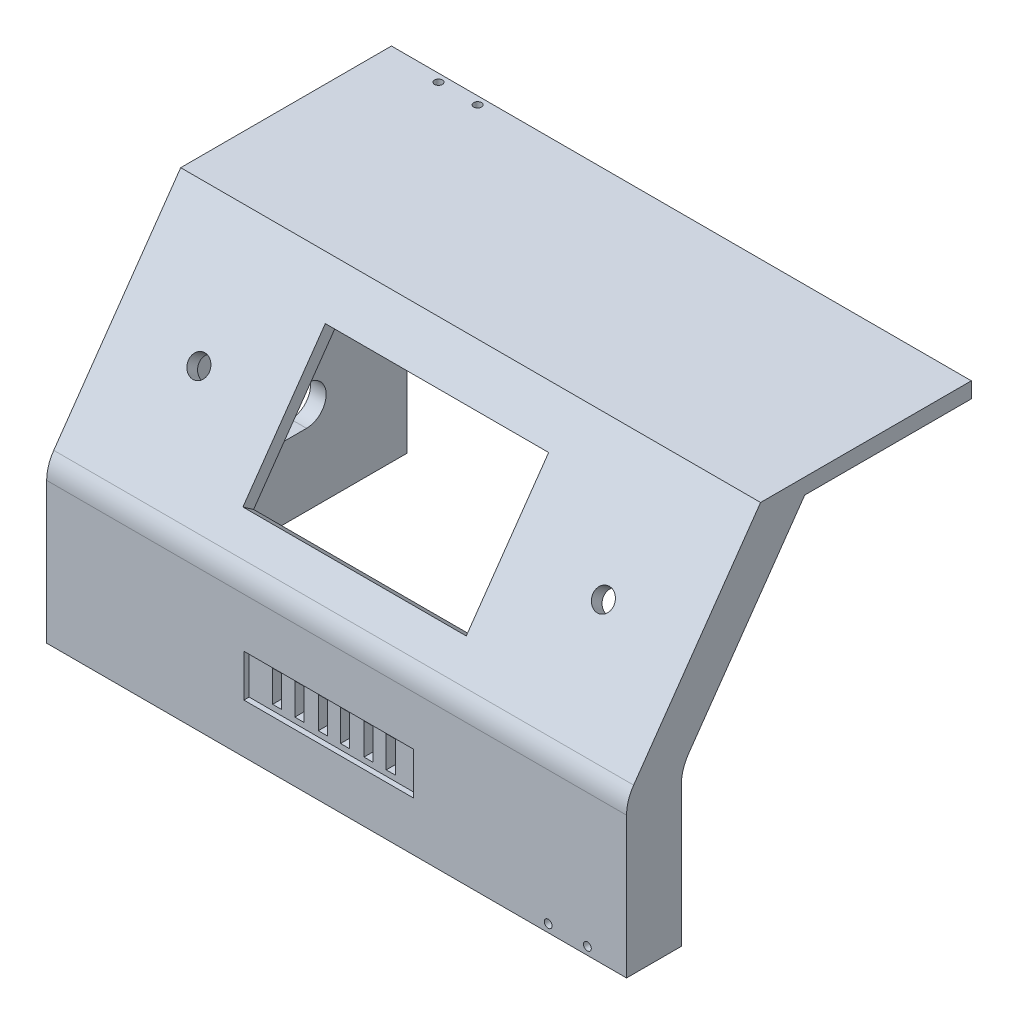
from build123d import *

# Parameters (mm, degrees)
SKETCH1_W            = 111
SKETCH1_H            = 126
BOSS_EXTRUDE1_DEPTH  = 6
SKETCH2_W            = 216
SKETCH2_H            = 111
BOSS_EXTRUDE2_DEPTH  = 6
SKETCH3_W            = 216
SKETCH3_H            = 132
BOSS_EXTRUDE3_DEPTH  = 6
SKETCH5_W            = 216
SKETCH5_H            = 99.986345045
CUT_EXTRUDE1_DEPTH   = 75
SKETCH7_W            = 216
SKETCH7_H            = 99.986345045
BOSS_EXTRUDE4_DEPTH  = 5
CUT_EXTRUDE2_DEPTH   = 314
SKETCH9_W            = 85.5
SKETCH9_H            = 55
CUT_EXTRUDE3_DEPTH   = 14
FILLET1_R            = 15
CUT_EXTRUDE4_DEPTH   = 27
SKETCH11_W           = 65
SKETCH11_H           = 16.2
CUT_EXTRUDE5_DEPTH   = 2
SKETCH12_W           = 3.5
SKETCH12_H           = 12
CUT_EXTRUDE6_DEPTH   = 11
BOSS_EXTRUDE5_DEPTH  = 6
SKETCH22_R           = 1.5
CUT_EXTRUDE13_DEPTH  = 20
BOSS_EXTRUDE6_DEPTH  = 15
SKETCH25_R           = 1.5
CUT_EXTRUDE14_DEPTH  = 15
BOSS_EXTRUDE9_START  = -6
BOSS_EXTRUDE9_DEPTH  = 6
SKETCH35_W           = 210
SKETCH35_H           = 6
SKETCH35_R           = 1.5
BOSS_EXTRUDE10_DEPTH = 15
SKETCH36_R           = 4
CUT_EXTRUDE16_DEPTH  = 15
SKETCH37_R           = 4
CUT_EXTRUDE17_DEPTH  = 15


with BuildPart() as part:
    # Sketch1 → Boss-Extrude1 (new body)
    with BuildSketch(Plane(origin=(0, 0, 0), x_dir=(0, 0, -1), z_dir=(1, 0, 0))):
        with Locations((55.5, 63)):
            Rectangle(SKETCH1_W, SKETCH1_H)
    extrude(amount=BOSS_EXTRUDE1_DEPTH)

    # Sketch2 → Boss-Extrude2 (add)
    with BuildSketch(Plane(origin=(0, 126, 0), x_dir=(1, 0, 0), z_dir=(0, 1, 0))):
        with Locations((108, 55.5)):
            Rectangle(SKETCH2_W, SKETCH2_H)
    extrude(amount=BOSS_EXTRUDE2_DEPTH)

    # Sketch3 → Boss-Extrude3 (add)
    with BuildSketch(Plane.XY):
        with Locations((108, 66)):
            Rectangle(SKETCH3_W, SKETCH3_H)
    extrude(amount=BOSS_EXTRUDE3_DEPTH)

    # Sketch5 → Cut-Extrude1 (cut)
    with BuildSketch(Plane(origin=(0, 19.268574279, 27.51837595), x_dir=(1, 0, 0), z_dir=(0, -0.5735764363510416, -0.8191520442889949))):
        with Locations((108, -87.509316119)):
            Rectangle(SKETCH5_W, SKETCH5_H)
    extrude(amount=-CUT_EXTRUDE1_DEPTH, mode=Mode.SUBTRACT)

    # Sketch7 → Boss-Extrude4 (add)
    with BuildSketch(Plane(origin=(0, 19.268574279, 27.51837595), x_dir=(1, 0, 0), z_dir=(0, -0.5735764363510416, -0.8191520442889949))):
        with Locations((108, -87.509316119)):
            Rectangle(SKETCH7_W, SKETCH7_H)
    extrude(amount=-BOSS_EXTRUDE4_DEPTH)

    # Sketch8 → Cut-Extrude2 (cut)
    with BuildSketch(Plane(origin=(216, 0, 0), x_dir=(0, 0, -1), z_dir=(1, 0, 0))):
        Polygon((-6, 50), (-6, 58.717233978), (-10.095760221, 52.867882182), align=None)
        Polygon((51.212736322, 132), (45.313145189, 132), (47.254051253, 134.771901126), align=None)
    extrude(amount=-CUT_EXTRUDE2_DEPTH, mode=Mode.SUBTRACT)

    # Sketch9 → Cut-Extrude3 (cut)
    with BuildSketch(Plane(origin=(0, 22.136456461, 31.614136171), x_dir=(1, 0, 0), z_dir=(0, 0.5735764363510417, 0.8191520442889949))):
        with Locations((108, 89.387752907)):
            Rectangle(SKETCH9_W, SKETCH9_H)
    extrude(amount=-CUT_EXTRUDE3_DEPTH, mode=Mode.SUBTRACT)

    # Fillet1
    fillet1_edges = [part.edges().sort_by_distance(p)[0] for p in [
        (111, 58.56888804, 0),
        (108, 58.717233978, 6),
    ]]
    fillet(fillet1_edges, radius=FILLET1_R)

    # Sketch10 → Cut-Extrude4 (cut)
    with BuildSketch(Plane.ZY):
        with BuildLine():
            Line((-87.5, 42.5), (-17.5, 42.5))
            ThreePointArc((-17.5, 42.5), (-10, 35), (-17.5, 27.5))
            Line((-17.5, 27.5), (-87.5, 27.5))
            ThreePointArc((-87.5, 27.5), (-95, 35), (-87.5, 42.5))
        make_face()
        with BuildLine():
            Line((-89.152421831, 99.5), (-39.152421831, 99.5))
            ThreePointArc((-39.152421831, 99.5), (-31.652421831, 92), (-39.152421831, 84.5))
            Line((-39.152421831, 84.5), (-89.152421831, 84.5))
            ThreePointArc((-89.152421831, 84.5), (-96.652421831, 92), (-89.152421831, 99.5))
        make_face()
    extrude(amount=-CUT_EXTRUDE4_DEPTH, mode=Mode.SUBTRACT)

    # Sketch11 → Cut-Extrude5 (cut)
    with BuildSketch(Plane.XY.offset(6)):
        with Locations((108, 26.993876072)):
            Rectangle(SKETCH11_W, SKETCH11_H)
    extrude(amount=-CUT_EXTRUDE5_DEPTH, mode=Mode.SUBTRACT)

    # Sketch12 → Cut-Extrude6 (cut)
    with BuildSketch(Plane.XY.offset(4)):
        with Locations((86.25, 26.993876072)):
            Rectangle(SKETCH12_W, SKETCH12_H)
        with Locations((94.75, 26.993876072)):
            Rectangle(SKETCH12_W, SKETCH12_H)
        with Locations((103.75, 26.993876072)):
            Rectangle(SKETCH12_W, SKETCH12_H)
        with Locations((112.25, 26.993876072)):
            Rectangle(SKETCH12_W, SKETCH12_H)
        with Locations((121.25, 26.993876072)):
            Rectangle(SKETCH12_W, SKETCH12_H)
        with Locations((129.75, 26.993876072)):
            Rectangle(SKETCH12_W, SKETCH12_H)
    extrude(amount=-CUT_EXTRUDE6_DEPTH, mode=Mode.SUBTRACT)

    # Sketch13 → Boss-Extrude5 (add)
    with BuildSketch(Plane(origin=(216, 0, 0), x_dir=(0, 0, -1), z_dir=(1, 0, 0))):
        with BuildLine():
            Line((111, 126), (111, 132))
            Line((111, 132), (45.313145189, 132))
            Line((45.313145189, 132), (-3.287280664, 62.59139869))
            ThreePointArc((-3.287280664, 62.59139869), (-5.305754261, 58.498339137), (-6, 53.987752145))
            Line((-6, 53.987752145), (-6, 0))
            Line((-6, 0), (0, 0))
            Line((0, 0), (0, 53.839406207))
            ThreePointArc((0, 53.839406207), (0.694245739, 58.3499932), (2.712719336, 62.443052753))
            Line((2.712719336, 62.443052753), (47.215772904, 126))
            Line((47.215772904, 126), (111, 126))
        make_face()
    extrude(amount=BOSS_EXTRUDE5_DEPTH)

    # Sketch22 → Cut-Extrude13 (cut)
    with BuildSketch(Plane.XY.offset(6)):
        with Locations((207, 3)):
            Circle(SKETCH22_R)
        with Locations((192, 3)):
            Circle(SKETCH22_R)
    extrude(amount=-CUT_EXTRUDE13_DEPTH, mode=Mode.SUBTRACT)

    # Sketch24 → Boss-Extrude6 (add)
    with BuildSketch(Plane(origin=(0, 0, -111), x_dir=(-1, 0, 0), z_dir=(0, 0, -1))):
        Polygon((-222, 132), (-222, 126), (-6, 126), (-6, 0), (0, 0), (0, 132), align=None)
    extrude(amount=BOSS_EXTRUDE6_DEPTH)

    # Sketch25 → Cut-Extrude14 (cut)
    with BuildSketch(Plane(origin=(0, 132, 0), x_dir=(1, 0, 0), z_dir=(0, 1, 0))):
        with Locations(Location((21, 123, 0), (0, 0, 270))):
            Circle(SKETCH25_R)
        with Locations(Location((36, 123, 0), (0, 0, 270))):
            Circle(SKETCH25_R)
    extrude(amount=-CUT_EXTRUDE14_DEPTH, mode=Mode.SUBTRACT)

    # Sketch34 → Boss-Extrude9 (add)
    with BuildSketch(Plane(origin=(222, 0, 0), x_dir=(0, 0, -1), z_dir=(1, 0, 0)).offset(BOSS_EXTRUDE9_START)):
        with BuildLine():
            Line((2.712719336, 62.443052753), (47.215772904, 126))
            Line((47.215772904, 126), (62.215772904, 126))
            Line((62.215772904, 126), (17.712719336, 62.443052753))
            ThreePointArc((17.712719336, 62.443052753), (15.694245739, 58.3499932), (15, 53.839406207))
            Line((15, 53.839406207), (15, 0))
            Line((15, 0), (0, 0))
            Line((0, 0), (0, 53.839406207))
            ThreePointArc((0, 53.839406207), (0.694245739, 58.3499932), (2.712719336, 62.443052753))
        make_face()
    extrude(amount=BOSS_EXTRUDE9_DEPTH)

    # Sketch35 → Boss-Extrude10 (add)
    with BuildSketch(Plane(origin=(0, 0, 0), x_dir=(-1, 0, 0), z_dir=(0, 0, -1))):
        with Locations((-111, 3)):
            Rectangle(SKETCH35_W, SKETCH35_H)
        with Locations(Location((-207, 3, 0), (0, 0, 180))):
            Circle(SKETCH35_R, mode=Mode.SUBTRACT)
        with Locations(Location((-192, 3, 0), (0, 0, 180))):
            Circle(SKETCH35_R, mode=Mode.SUBTRACT)
    extrude(amount=BOSS_EXTRUDE10_DEPTH)

    # Sketch36 → Cut-Extrude16 (cut)
    with BuildSketch(Plane(origin=(0, 22.136456461, 31.614136171), x_dir=(1, 0, 0), z_dir=(0, 0.5735764363510417, 0.8191520442889949))):
        with Locations(Location((187.47755458, 89.387752907, 0), (0, 0, 270))):
            Circle(SKETCH36_R)
    extrude(amount=-CUT_EXTRUDE16_DEPTH, mode=Mode.SUBTRACT)

    # Sketch37 → Cut-Extrude17 (cut)
    with BuildSketch(Plane(origin=(0, 22.136456461, 31.614136171), x_dir=(1, 0, 0), z_dir=(0, 0.5735764363510417, 0.8191520442889949))):
        with Locations(Location((32.625, 89.387752907, 0), (0, 0, 270))):
            Circle(SKETCH37_R)
    extrude(amount=-CUT_EXTRUDE17_DEPTH, mode=Mode.SUBTRACT)


solid = part.part
